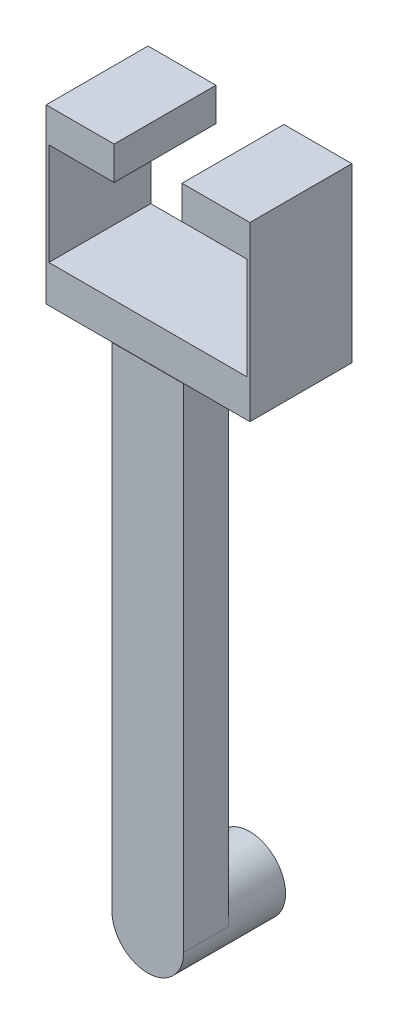
from build123d import *

# Parameters (mm, degrees)
SKETCH2_R           = 13.4112
BOSS_EXTRUDE1_DEPTH = 38.1
SKETCH5_W           = 26.8224
SKETCH5_H           = 184.15
BOSS_EXTRUDE2_DEPTH = 16.7386
SKETCH8_W           = 76.2
SKETCH8_H           = 38.1
BOSS_EXTRUDE3_DEPTH = 13.97
SKETCH9_W           = 1.016
SKETCH9_H           = 38.1
BOSS_EXTRUDE4_DEPTH = 38.1
SKETCH10_W          = 25.4
SKETCH10_H          = 38.1
BOSS_EXTRUDE5_DEPTH = 12.446


with BuildPart() as part:
    # Sketch2 → Boss-Extrude1 (new body)
    with BuildSketch(Plane.XY):
        with Locations(Location((0, 0, 0), (0, 0, 180))):
            Circle(SKETCH2_R)
    extrude(amount=BOSS_EXTRUDE1_DEPTH)

    # Sketch5 → Boss-Extrude2 (add)
    with BuildSketch(Plane.XY.offset(38.1)):
        with Locations((0, 92.075)):
            Rectangle(SKETCH5_W, SKETCH5_H)
    extrude(amount=-BOSS_EXTRUDE2_DEPTH)

    # Sketch8 → Boss-Extrude3 (add)
    with BuildSketch(Plane(origin=(0, 184.15, 0), x_dir=(1, 0, 0), z_dir=(0, 1, 0))):
        with Locations((0, -18.948214994)):
            Rectangle(SKETCH8_W, SKETCH8_H)
    extrude(amount=BOSS_EXTRUDE3_DEPTH)

    # Sketch9 → Boss-Extrude4 (add)
    with BuildSketch(Plane(origin=(0, 198.12, 0), x_dir=(1, 0, 0), z_dir=(0, 1, 0))):
        with Locations((-37.592, -18.948214994)):
            Rectangle(SKETCH9_W, SKETCH9_H)
        with Locations((37.592, -18.948214994)):
            Rectangle(SKETCH9_W, SKETCH9_H)
    extrude(amount=BOSS_EXTRUDE4_DEPTH)

    # Sketch10 → Boss-Extrude5 (add)
    with BuildSketch(Plane(origin=(0, 236.22, 0), x_dir=(1, 0, 0), z_dir=(0, 1, 0))):
        with Locations((-25.4, -18.948214994)):
            Rectangle(SKETCH10_W, SKETCH10_H)
        with Locations((25.4, -18.948214994)):
            Rectangle(SKETCH10_W, SKETCH10_H)
    extrude(amount=BOSS_EXTRUDE5_DEPTH)


solid = part.part
